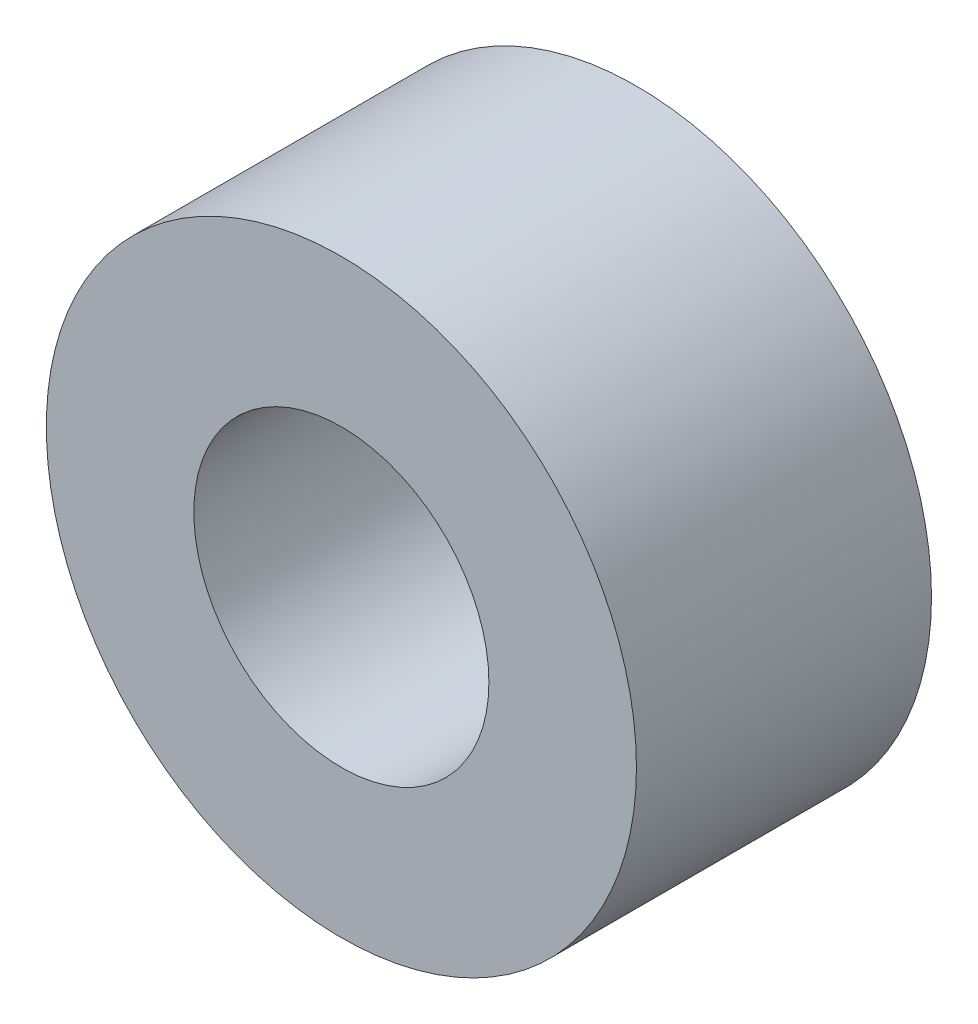
from build123d import *

# Parameters (mm, degrees)
SKETCH2_R           = 3.175
SKETCH2_R_2         = 1.5875
BOSS_EXTRUDE1_DEPTH = 3.175


with BuildPart() as part:
    # Sketch2 → Boss-Extrude1 (new body)
    with BuildSketch(Plane.XY):
        Circle(SKETCH2_R)
        Circle(SKETCH2_R_2, mode=Mode.SUBTRACT)
    extrude(amount=BOSS_EXTRUDE1_DEPTH)


solid = part.part
